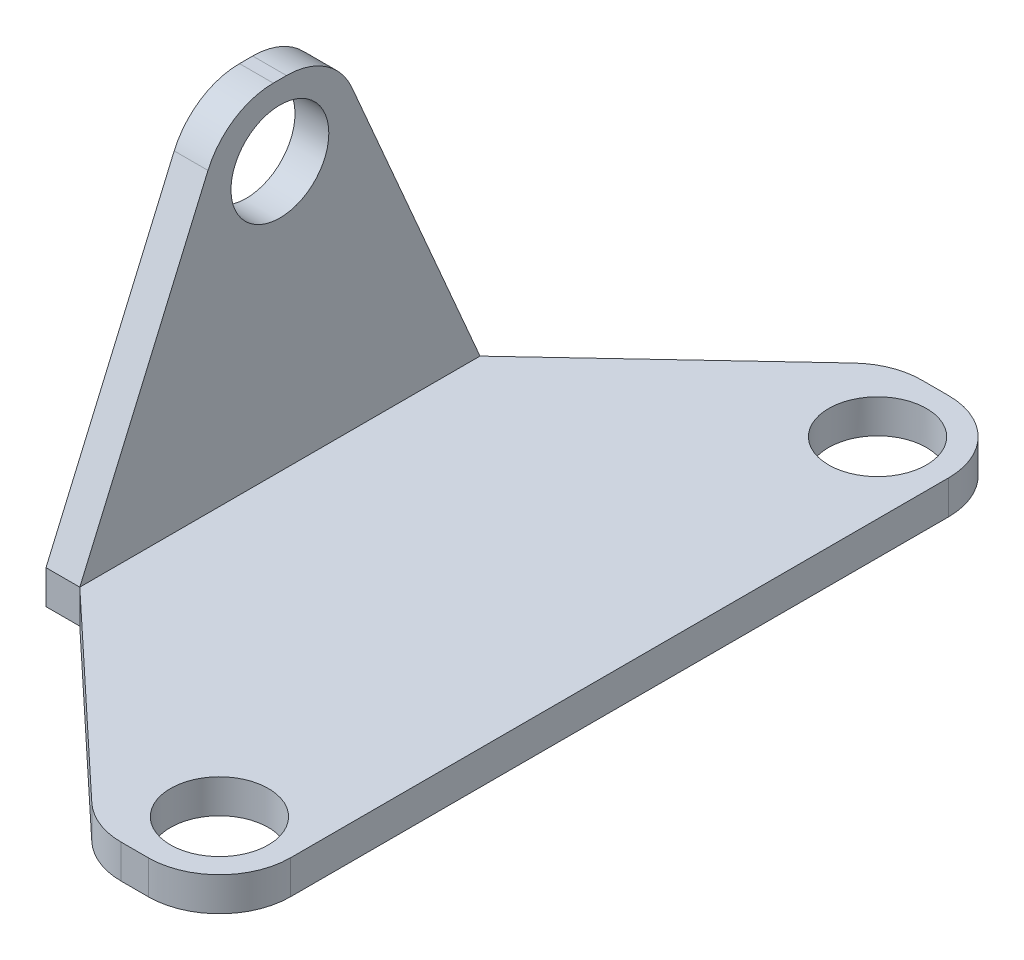
from build123d import *

# Parameters (mm, degrees)
ESBO_O3_W                  = 45
ESBO_O3_H                  = 1.9
CORTE_EXTRUS_O1_DEPTH      = 34.063063068
CORTE_EXTRUS_O1_DEPTH_BACK = 34.063063068
ESBO_O4_R                  = 2.75
ESBO_O5_R                  = 2.75
CORTE_EXTRUS_O2_DEPTH      = 34.971447122
FILETE1_R                  = 4


with BuildPart() as part:
    # Varredura2: sweep along a path in Esboço1
    with BuildLine(Plane.XY) as varredura2_path:
        Line((-16.822580645, 6.096774194), (-16.822580645, -14.903225806))
        Line((-16.822580645, -14.903225806), (4.177419355, -14.903225806))
    # Esboço3 → Varredura2 (sweep)
    with BuildSketch(Plane(origin=(4.177419355, 0, 0), x_dir=(0, 0, -1), z_dir=(1, 0, 0))):
        with Locations((0, -13.953225806)):
            Rectangle(ESBO_O3_W, ESBO_O3_H)
    sweep(path=varredura2_path.line, transition=Transition.RIGHT)

    # Esboço4 → Corte-extrusão1 (cut, two sides: drawn at the far end of the back side and taken through both)
    with BuildSketch(Plane(origin=(-14.922580645, 0, 0), x_dir=(0, 0, -1), z_dir=(1, 0, 0)).offset(-CORTE_EXTRUS_O1_DEPTH_BACK)):
        with Locations((0, 2.096774194)):
            Circle(ESBO_O4_R)
        Polygon((0, 6.096774194), (-3, 6.096774194), (-11.25, -13.003225806), (-24.249816644, -13.003225806), (-24.249816644, 8.86202898), (24.249816644, 8.86202898), (24.249816644, -13.003225806), (11.25, -13.003225806), (3, 6.096774194), align=None)
    extrude(amount=CORTE_EXTRUS_O1_DEPTH + CORTE_EXTRUS_O1_DEPTH_BACK, mode=Mode.SUBTRACT)

    # Esboço5 → Corte-extrusão2 (cut, symmetric)
    with BuildSketch(Plane(origin=(0, -13.003225806, 0), x_dir=(1, 0, 0), z_dir=(0, 1, 0))):
        with Locations(Location((0.177419355, -18.5, 0), (0, 0, 270))):
            Circle(ESBO_O5_R)
        Polygon((-14.922580645, -11.25), (-18.889664127, -11.25), (-18.889664127, -25.413435485), (7.454666431, -25.413435485), (7.454666431, -2.187603421), (4.177419355, -2.187603421), (4.177419355, -22.5), (-2.92481363, -22.5), align=None)
    corte_extrus_o2 = extrude(amount=CORTE_EXTRUS_O2_DEPTH, both=True, mode=Mode.SUBTRACT)

    # Espelhar1: Corte-extrusão2 across plane
    add(corte_extrus_o2.mirror(Plane.XY), mode=Mode.SUBTRACT)

    # Filete1
    filete1_edges = [part.edges().sort_by_distance(p)[0] for p in [
        (4.177419355, -13.953225806, -22.5),
        (4.177419355, -13.953225806, 22.5),
        (-2.92481363, -13.953225806, -22.5),
        (-15.872580645, 6.096774194, -3),
        (-15.872580645, 6.096774194, 3),
        (-2.92481363, -13.953225806, 22.5),
    ]]
    fillet(filete1_edges, radius=FILETE1_R)


solid = part.part
